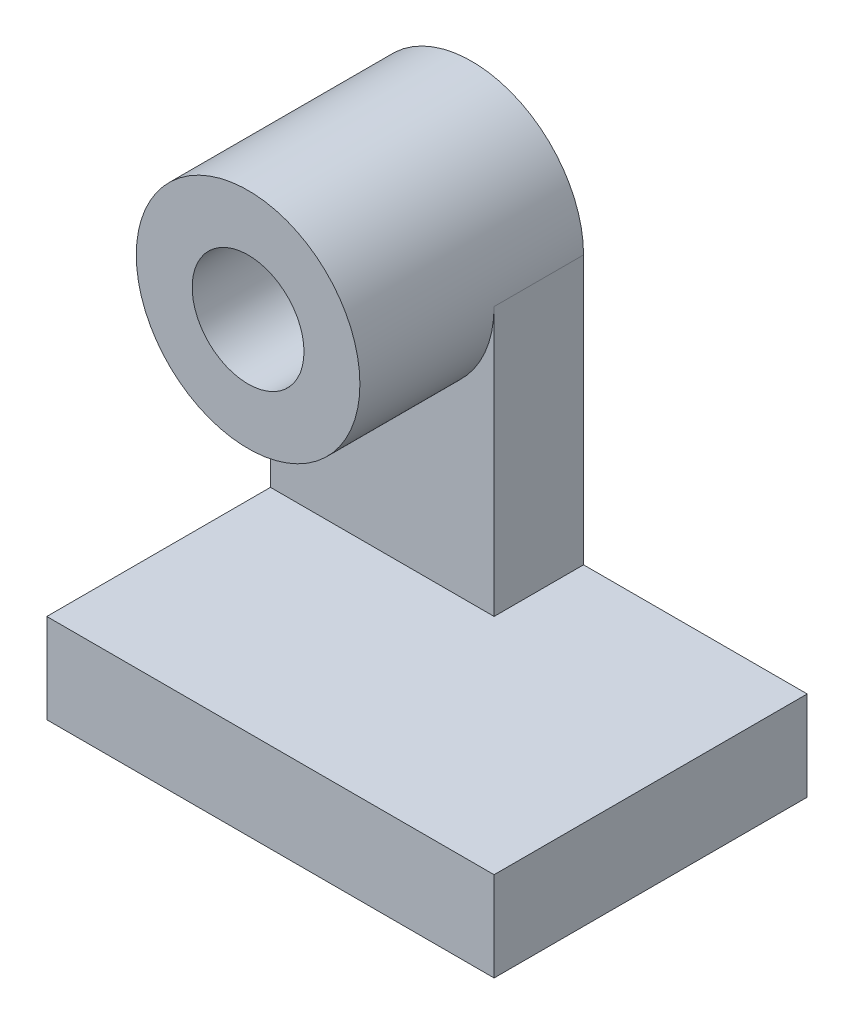
from build123d import *

# Parameters (mm, degrees)
SKETCH1_W           = 127
SKETCH1_H           = 25.4
BOSS_EXTRUDE1_DEPTH = 88.9
BOSS_EXTRUDE2_DEPTH = 25.4
SKETCH1_4_R         = 31.75
SKETCH1_4_R_2       = 15.875
BOSS_EXTRUDE3_DEPTH = 63.5


with BuildPart() as part:
    # Sketch1 → Boss-Extrude1 (new body)
    with BuildSketch(Plane.XY):
        with Locations((63.5, 12.7)):
            Rectangle(SKETCH1_W, SKETCH1_H)
    extrude(amount=BOSS_EXTRUDE1_DEPTH)

    # Sketch1<3> → Boss-Extrude2 (add)
    with BuildSketch(Plane.XY):
        with BuildLine():
            Line((0, 101.6), (0, 25.4))
            Line((0, 25.4), (63.5, 25.4))
            Line((63.5, 25.4), (63.5, 101.6))
            ThreePointArc((63.5, 101.6), (31.75, 69.85), (0, 101.6))
        make_face()
    extrude(amount=BOSS_EXTRUDE2_DEPTH)

    # Sketch1<4> → Boss-Extrude3 (add)
    with BuildSketch(Plane.XY):
        with Locations((31.75, 101.6)):
            Circle(SKETCH1_4_R)
        with Locations((31.75, 101.6)):
            Circle(SKETCH1_4_R_2, mode=Mode.SUBTRACT)
    extrude(amount=BOSS_EXTRUDE3_DEPTH)


solid = part.part
